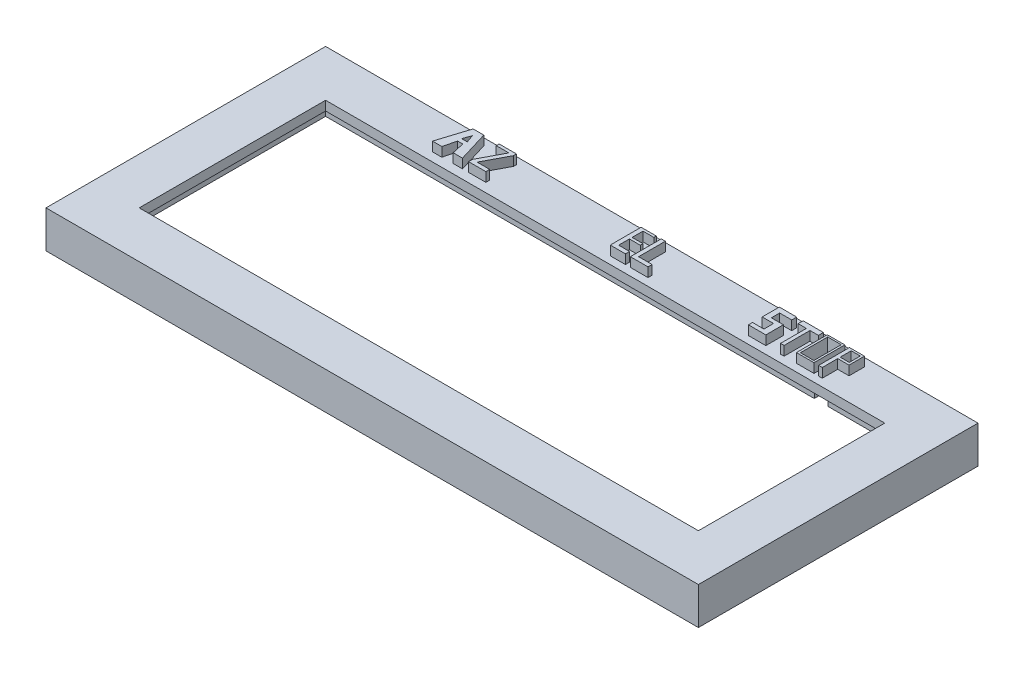
from build123d import *

# Parameters (mm, degrees)
SALIENTE_EXTRUIR1_DEPTH   = 5
SALIENTE_EXTRUIR1_2_DEPTH = 5
SALIENTE_EXTRUIR1_3_DEPTH = 5
SALIENTE_EXTRUIR1_4_DEPTH = 5
SALIENTE_EXTRUIR1_5_DEPTH = 5
SALIENTE_EXTRUIR1_6_DEPTH = 5
CROQUIS1_W                = 1.882038395
CROQUIS1_H                = 3.311920174
CROQUIS1_W_2              = 1.44614363
CROQUIS1_H_2              = 2.931372224
SALIENTE_EXTRUIR1_7_DEPTH = 5
CROQUIS1_W_3              = 0.976947733
CROQUIS1_H_3              = 1.190080085
SALIENTE_EXTRUIR1_8_DEPTH = 5
CROQUIS1_3_W              = 70
CROQUIS1_3_H              = 30
CROQUIS1_3_W_2            = 60
CROQUIS1_3_H_2            = 20
CROQUIS1_3_W_3            = 1.882038395
CROQUIS1_3_H_3            = 3.311920174
SALIENTE_EXTRUIR2_DEPTH   = 4
CROQUIS3_W                = 65
CROQUIS3_H                = 25
CORTAR_EXTRUIR1_DEPTH     = 3


with BuildPart() as part:
    # Croquis1 → Saliente-Extruir1 (new body)
    with BuildSketch(Plane(origin=(0, 0, 0), x_dir=(1, 0, 0), z_dir=(0, 1, 0))):
        Polygon((-381.088562756, 251.423394178), (-382.133986502, 248.111474004), (-381.133986502, 248.111474004), (-380.795875473, 249.462867756), (-380.240129471, 249.462867756), (-379.943592304, 248.138701402), (-378.943592304, 248.138701402), (-379.943592304, 251.423394178), align=None)
        Polygon((-380.2013533, 249.904754056), (-380.795875473, 249.904754056), (-380.498614386, 250.764925918), align=None, mode=Mode.SUBTRACT)
    extrude(amount=SALIENTE_EXTRUIR1_DEPTH)



with BuildPart() as body_2:
    # Croquis1 → Saliente-Extruir1 2 (new body)
    with BuildSketch(Plane(origin=(0, 0, 0), x_dir=(1, 0, 0), z_dir=(0, 1, 0))):
        Polygon((-376.436891972, 251.423394178), (-378.294984375, 251.423394178), (-378.294984375, 251.111377613), (-376.940948953, 251.111377613), (-378.294984375, 248.551558823), (-378.294984375, 248.138701402), (-376.436891972, 248.138701402), (-376.436891972, 248.551558823), (-377.790927393, 248.551558823), (-376.436891972, 251.111377613), align=None)
    extrude(amount=SALIENTE_EXTRUIR1_2_DEPTH)


with BuildPart() as body_3:
    # Croquis1 → Saliente-Extruir1 3 (new body)
    with BuildSketch(Plane(origin=(0, 0, 0), x_dir=(1, 0, 0), z_dir=(0, 1, 0))):
        Polygon((-361.312091548, 251.300316154), (-362.939380698, 251.300316154), (-362.939380698, 247.98839598), (-361.310931064, 247.98839598), (-361.310931064, 248.428480798), (-362.478498726, 248.428480798), (-362.478498726, 249.584160603), (-361.310931064, 249.584160603), (-361.310931064, 249.871397066), (-362.478498726, 249.871397066), (-362.478498726, 251.039680014), (-361.312091548, 251.039680014), align=None)
    extrude(amount=SALIENTE_EXTRUIR1_3_DEPTH)


with BuildPart() as body_4:
    # Croquis1 → Saliente-Extruir1 4 (new body)
    with BuildSketch(Plane(origin=(0, 0, 0), x_dir=(1, 0, 0), z_dir=(0, 1, 0))):
        Polygon((-360.339718911, 251.300316154), (-360.779331555, 251.300316154), (-360.779331555, 247.98839598), (-358.890625378, 247.98839598), (-358.890625378, 248.428480798), (-360.339718911, 248.428480798), align=None)
    extrude(amount=SALIENTE_EXTRUIR1_4_DEPTH)


with BuildPart() as body_5:
    # Croquis1 → Saliente-Extruir1 5 (new body)
    with BuildSketch(Plane(origin=(0, 0, 0), x_dir=(1, 0, 0), z_dir=(0, 1, 0))):
        Polygon((-346.246917904, 251.300316154), (-348.110575355, 251.300316154), (-348.110575355, 249.462867756), (-346.892030098, 249.462867756), (-346.892030098, 248.428480798), (-348.110575355, 248.428480798), (-348.110575355, 247.98839598), (-346.246917904, 247.98839598), (-346.246917904, 249.871397066), (-347.537142293, 249.871397066), (-347.537142293, 250.764925918), (-346.246917904, 250.764925918), align=None)
    extrude(amount=SALIENTE_EXTRUIR1_5_DEPTH)


with BuildPart() as body_6:
    # Croquis1 → Saliente-Extruir1 6 (new body)
    with BuildSketch(Plane(origin=(0, 0, 0), x_dir=(1, 0, 0), z_dir=(0, 1, 0))):
        Polygon((-343.379752594, 251.300316154), (-345.558798229, 251.300316154), (-345.558798229, 250.764925918), (-344.670110195, 250.764925918), (-344.670110195, 247.98839598), (-344.28749707, 247.98839598), (-344.28749707, 250.764925918), (-343.379752594, 250.764925918), align=None)
    extrude(amount=SALIENTE_EXTRUIR1_6_DEPTH)


with BuildPart() as body_7:
    # Croquis1 → Saliente-Extruir1 7 (new body)
    with BuildSketch(Plane(origin=(0, 0, 0), x_dir=(1, 0, 0), z_dir=(0, 1, 0))):
        with Locations((-342.02217467, 249.644356067)):
            Rectangle(CROQUIS1_W, CROQUIS1_H)
        with Locations((-342.011459779, 249.652215762)):
            Rectangle(CROQUIS1_W_2, CROQUIS1_H_2, mode=Mode.SUBTRACT)
    extrude(amount=SALIENTE_EXTRUIR1_7_DEPTH)


with BuildPart() as body_8:
    # Croquis1 → Saliente-Extruir1 8 (new body)
    with BuildSketch(Plane(origin=(0, 0, 0), x_dir=(1, 0, 0), z_dir=(0, 1, 0))):
        Polygon((-338.977474459, 251.300316154), (-340.583262112, 251.300316154), (-340.583262112, 247.98839598), (-340.190237162, 247.98839598), (-340.190237162, 249.644356067), (-338.977474459, 249.644356067), align=None)
        with Locations((-339.701763296, 250.499794098)):
            Rectangle(CROQUIS1_W_3, CROQUIS1_H_3, mode=Mode.SUBTRACT)
    extrude(amount=SALIENTE_EXTRUIR1_8_DEPTH)


with BuildPart() as part_1:
    add(part.part)

    add(body_2.part)  # Saliente-Extruir2 merges body 2

    add(body_3.part)  # Saliente-Extruir2 merges body 3

    add(body_4.part)  # Saliente-Extruir2 merges body 4

    add(body_5.part)  # Saliente-Extruir2 merges body 5

    add(body_6.part)  # Saliente-Extruir2 merges body 6

    add(body_7.part)  # Saliente-Extruir2 merges body 7

    add(body_8.part)  # Saliente-Extruir2 merges body 8
    # Croquis1<3> → Saliente-Extruir2 (add)
    with BuildSketch(Plane(origin=(0, 0, 0), x_dir=(1, 0, 0), z_dir=(0, 1, 0))):
        with Locations((-362.667441108, 237.173755489)):
            Rectangle(CROQUIS1_3_W, CROQUIS1_3_H)
        Polygon((-381.133986502, 248.111474004), (-382.133986502, 248.111474004), (-381.088562756, 251.423394178), (-379.943592304, 251.423394178), (-378.943592304, 248.138701402), (-379.943592304, 248.138701402), (-380.240129471, 249.462867756), (-380.795875473, 249.462867756), align=None, mode=Mode.SUBTRACT)
        Polygon((-378.294984375, 251.111377613), (-378.294984375, 251.423394178), (-376.436891972, 251.423394178), (-376.436891972, 251.111377613), (-377.790927393, 248.551558823), (-376.436891972, 248.551558823), (-376.436891972, 248.138701402), (-378.294984375, 248.138701402), (-378.294984375, 248.551558823), (-376.940948953, 251.111377613), align=None, mode=Mode.SUBTRACT)
        with Locations((-362.667441108, 237.173755489)):
            Rectangle(CROQUIS1_3_W_2, CROQUIS1_3_H_2, mode=Mode.SUBTRACT)
        Polygon((-362.939380698, 247.98839598), (-362.939380698, 251.300316154), (-361.312091548, 251.300316154), (-361.312091548, 251.039680014), (-362.478498726, 251.039680014), (-362.478498726, 249.871397066), (-361.310931064, 249.871397066), (-361.310931064, 249.584160603), (-362.478498726, 249.584160603), (-362.478498726, 248.428480798), (-361.310931064, 248.428480798), (-361.310931064, 247.98839598), align=None, mode=Mode.SUBTRACT)
        Polygon((-360.779331555, 247.98839598), (-360.779331555, 251.300316154), (-360.339718911, 251.300316154), (-360.339718911, 248.428480798), (-358.890625378, 248.428480798), (-358.890625378, 247.98839598), align=None, mode=Mode.SUBTRACT)
        Polygon((-348.110575355, 249.462867756), (-348.110575355, 251.300316154), (-346.246917904, 251.300316154), (-346.246917904, 250.764925918), (-347.537142293, 250.764925918), (-347.537142293, 249.871397066), (-346.246917904, 249.871397066), (-346.246917904, 249.462867756), (-346.246917904, 247.98839598), (-348.110575355, 247.98839598), (-348.110575355, 248.428480798), (-346.892030098, 248.428480798), (-346.892030098, 249.462867756), align=None, mode=Mode.SUBTRACT)
        Polygon((-345.558798229, 250.764925918), (-345.558798229, 251.300316154), (-343.379752594, 251.300316154), (-343.379752594, 250.764925918), (-344.28749707, 250.764925918), (-344.28749707, 247.98839598), (-344.670110195, 247.98839598), (-344.670110195, 250.764925918), align=None, mode=Mode.SUBTRACT)
        with Locations((-342.02217467, 249.644356067)):
            Rectangle(CROQUIS1_3_W_3, CROQUIS1_3_H_3, mode=Mode.SUBTRACT)
        Polygon((-340.583262112, 247.98839598), (-340.583262112, 251.300316154), (-338.977474459, 251.300316154), (-338.977474459, 249.644356067), (-340.190237162, 249.644356067), (-340.190237162, 247.98839598), align=None, mode=Mode.SUBTRACT)
    extrude(amount=SALIENTE_EXTRUIR2_DEPTH)

    # Croquis3 → Cortar-Extruir1 (cut)
    with BuildSketch(Plane.XZ):
        with Locations((-362.667441108, -237.173755489)):
            Rectangle(CROQUIS3_W, CROQUIS3_H)
    extrude(amount=-CORTAR_EXTRUIR1_DEPTH, mode=Mode.SUBTRACT)


solid = part_1.part
